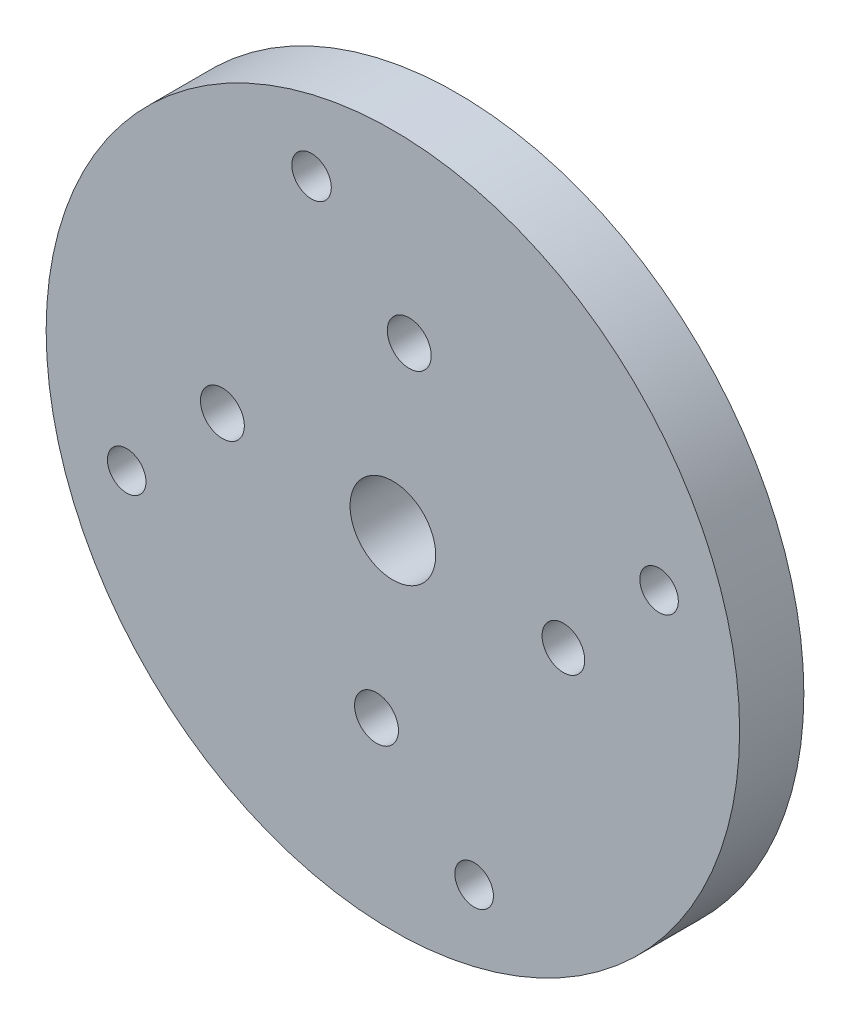
from build123d import *

# Parameters (mm, degrees)
ESQUISSE1_R             = 16.195590531
ESQUISSE1_R_2           = 2
BOSS_EXTRU_1_DEPTH      = 3
ESQUISSE3_R             = 0.997616065
ESQUISSE3_R_2           = 1.025
ESQUISSE3_R_3           = 0.922873217
ESQUISSE3_R_4           = 0.9
ENL_V_MAT_EXTRU_2_DEPTH = 24.099660286


with BuildPart() as part:
    # Esquisse1 → Boss.-Extru.1 (new body)
    with BuildSketch(Plane.XY):
        Circle(ESQUISSE1_R)
        Circle(ESQUISSE1_R_2, mode=Mode.SUBTRACT)
    extrude(amount=BOSS_EXTRU_1_DEPTH)

    # Esquisse3 → Enlèv. mat.-Extru.2 (cut, through all)
    with BuildSketch(Plane.XY.offset(3)):
        with Locations((7.963371834, -0.764662688)):
            Circle(ESQUISSE3_R)
        with Locations((0.764662688, 7.963371834)):
            Circle(ESQUISSE3_R_2)
        with Locations((-7.963371834, 0.764662688)):
            Circle(ESQUISSE3_R_2)
        with Locations((-0.764662688, -7.963371834)):
            Circle(ESQUISSE3_R_2)
        with Locations((-3.799406279, 12.432397674)):
            Circle(ESQUISSE3_R_3)
        with Locations((12.432397674, 3.799406279)):
            Circle(ESQUISSE3_R_4)
        with Locations((3.795228677, -12.433673604)):
            Circle(ESQUISSE3_R_4)
        with Locations((-12.432397674, -3.799406279)):
            Circle(ESQUISSE3_R_4)
    extrude(amount=-ENL_V_MAT_EXTRU_2_DEPTH, mode=Mode.SUBTRACT)


solid = part.part
